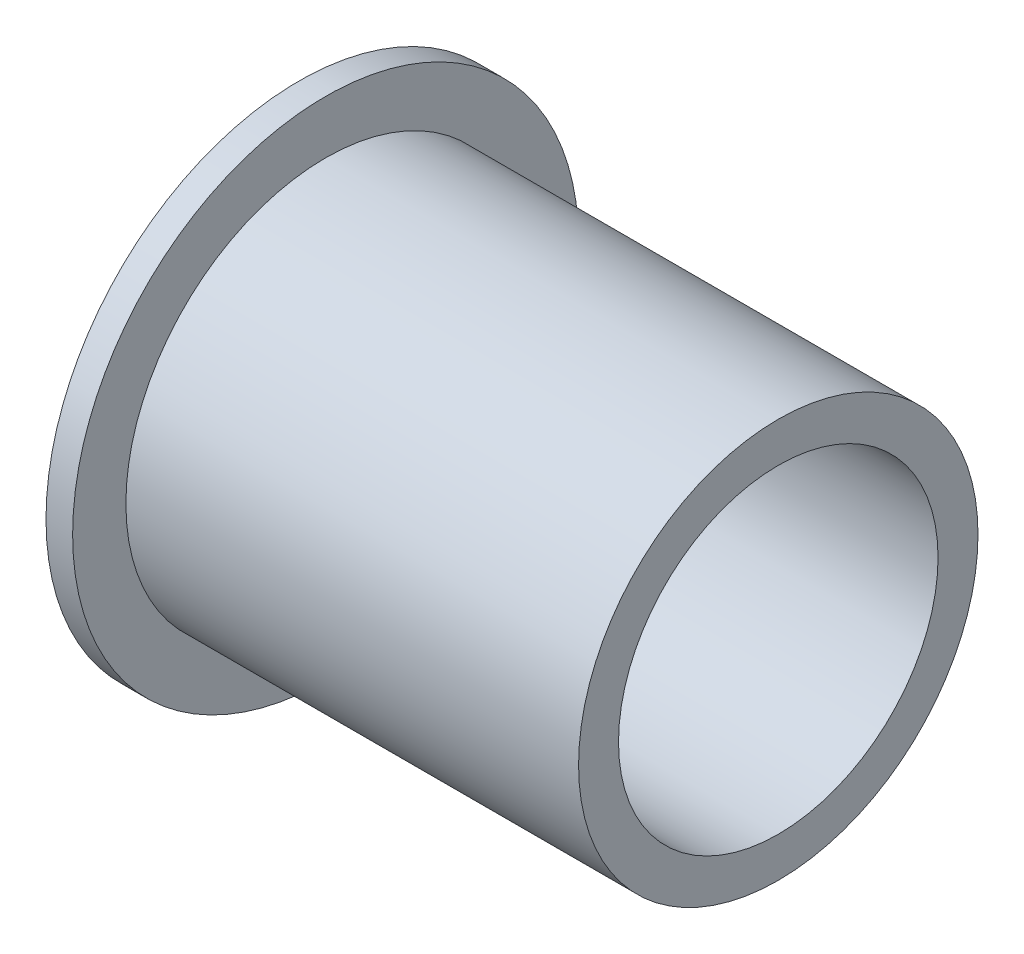
from build123d import *


with BuildPart() as part:
    # Sketch1 → Revolve1 (revolve)
    with BuildSketch(Plane.XY, mode=Mode.PRIVATE) as revolve1_sk:
        Polygon((0, 0), (3.175, 0), (3.175, 6.35), (57.15, 6.35), (57.15, 11.1125), (0, 11.1125), align=None)
    revolve(revolve1_sk.sketch.rotate(Axis((57.15, 30.1625, 0), (-1, 0, 0)), 270), axis=Axis((57.15, 30.1625, 0), (-1, 0, 0)))


solid = part.part
